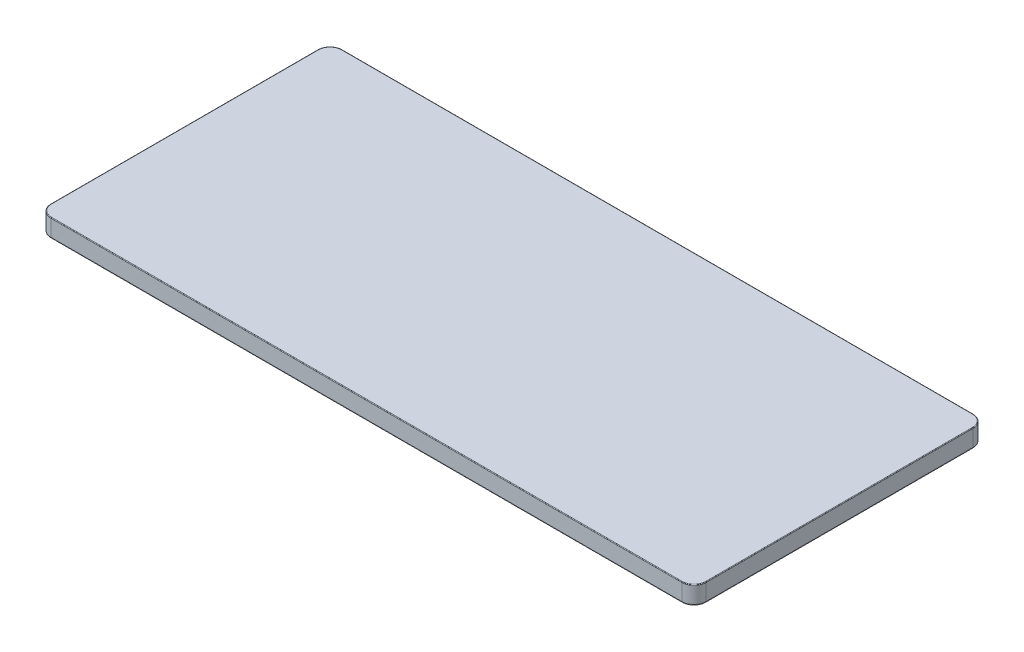
from build123d import *

# Parameters (mm, degrees)
BOSS_EXTRUDE1_DEPTH = 38.1
FILLET1_R           = 2.54
FILLET2_R           = 1.27
SKETCH2_R           = 1.5875
CUT_EXTRUDE1_DEPTH  = 12.7


with BuildPart() as part:
    # Sketch1 → Boss-Extrude1 (new body)
    with BuildSketch(Plane(origin=(0, 0, 0), x_dir=(1, 0, 0), z_dir=(0, 1, 0))):
        with BuildLine():
            Line((-660.4, -304.8), (660.4, -304.8))
            ThreePointArc((660.4, -304.8), (678.360512242, -297.360512242), (685.8, -279.4))
            Line((685.8, -279.4), (685.8, 279.4))
            ThreePointArc((685.8, 279.4), (678.360512242, 297.360512242), (660.4, 304.8))
            Line((660.4, 304.8), (-660.4, 304.8))
            ThreePointArc((-660.4, 304.8), (-678.360512242, 297.360512242), (-685.8, 279.4))
            Line((-685.8, 279.4), (-685.8, -279.4))
            ThreePointArc((-685.8, -279.4), (-678.360512242, -297.360512242), (-660.4, -304.8))
        make_face()
    extrude(amount=-BOSS_EXTRUDE1_DEPTH)

    # Fillet1
    fillet1_edges = [part.edges().sort_by_distance(p)[0] for p in [
        (678.360512242, -38.1, -297.360512242),
        (0, -38.1, -304.8),
        (-678.360512242, -38.1, -297.360512242),
        (-685.8, -38.1, 0),
        (-678.360512242, -38.1, 297.360512242),
        (0, -38.1, 304.8),
        (678.360512242, -38.1, 297.360512242),
        (685.8, -38.1, 0),
    ]]
    fillet(fillet1_edges, radius=FILLET1_R)

    # Fillet2
    fillet2_edges = [part.edges().sort_by_distance(p)[0] for p in [
        (0, 0, -304.8),
        (678.360512242, 0, -297.360512242),
        (685.8, 0, 0),
        (678.360512242, 0, 297.360512242),
        (0, 0, 304.8),
        (-678.360512242, 0, 297.360512242),
        (-685.8, 0, 0),
        (-678.360512242, 0, -297.360512242),
    ]]
    fillet(fillet2_edges, radius=FILLET2_R)

    # Sketch2 → Cut-Extrude1 (cut)
    with BuildSketch(Plane.XZ.offset(38.1)):
        with Locations(Location((-457.2, 127, 0), (0, 0, 270))):
            Circle(SKETCH2_R)
        with Locations(Location((-342.9, 127, 0), (0, 0, 270))):
            Circle(SKETCH2_R)
        with Locations(Location((342.9, 127, 0), (0, 0, 90))):
            Circle(SKETCH2_R)
        with Locations(Location((457.2, 127, 0), (0, 0, 90))):
            Circle(SKETCH2_R)
        with Locations(Location((-342.9, -127, 0), (0, 0, 90))):
            Circle(SKETCH2_R)
        with Locations(Location((-457.2, -127, 0), (0, 0, 90))):
            Circle(SKETCH2_R)
        with Locations(Location((457.2, -127, 0), (0, 0, 270))):
            Circle(SKETCH2_R)
        with Locations(Location((342.9, -127, 0), (0, 0, 270))):
            Circle(SKETCH2_R)
    extrude(amount=-CUT_EXTRUDE1_DEPTH, mode=Mode.SUBTRACT)


solid = part.part
